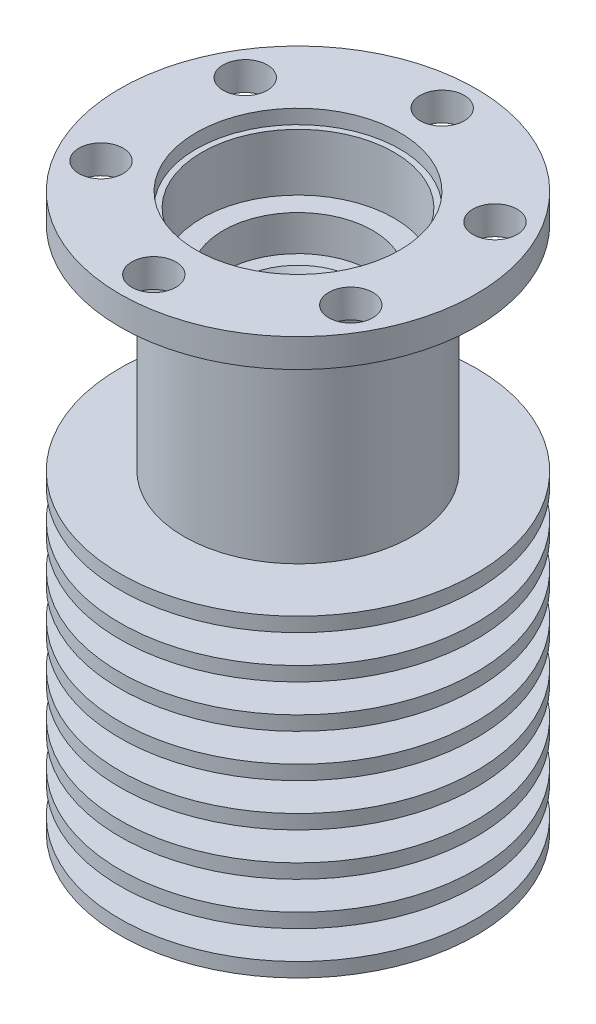
from build123d import *

# Parameters (mm, degrees)
SALIENTE_EXTRUIR1_START = -1
CROQUIS3_R              = 12.5
CROQUIS3_R_2            = 3.25
SALIENTE_EXTRUIR1_DEPTH = 1
MATRIZL1_COUNT          = 8
MATRIZL1_PITCH          = 3
CORTAR_EXTRUIR1_REACH   = 44.819
CROQUIS5_R              = 1.55
MATRIZC1_COUNT          = 6
CHAFL_N3_SIZE           = 0.3
CHAFL_N3_SIZE2          = 0.519615242
CROQUIS6_R              = 7.15
CORTAR_EXTRUIR2_DEPTH   = 1
CHAFL_N2_SIZE           = 0.15
CHAFL_N2_SIZE2          = 0.259807621
CHAFL_N4_SIZE           = 1
CHAFL_N4_SIZE2          = 1.732050808


with BuildPart() as part:
    # Croquis1 → Revolución1 (revolve)
    with BuildSketch(Plane.XY, mode=Mode.PRIVATE) as revoluci_n1_sk:
        Polygon((0, 0), (6, 0), (6, 9), (5.25, 9), (5.25, 12), (4.75, 12), (4.75, 22), (8, 22), (8, 37), (12.5, 37), (12.5, 39), (0, 39), align=None)
    revolve(revoluci_n1_sk.sketch.rotate(Axis((0, 39, 0), (0, -1, 0)), 90), axis=Axis((0, 39, 0), (0, -1, 0)))

    # Croquis2 → Cortar-Revolución1 (revolve, cut)
    with BuildSketch(Plane.XY, mode=Mode.PRIVATE) as cortar_revoluci_n1_sk:
        Polygon((0, 0), (2.5, 0), (2.5, 9), (1.7, 9), (1.7, 11), (3.25, 11), (3.25, 31.5), (5.25, 31.5), (5.25, 34), (6.75, 34), (6.75, 39), (0, 39), align=None)
    revolve(cortar_revoluci_n1_sk.sketch.rotate(Axis((0, 0, 0), (0, 1, 0)), 90), axis=Axis((0, 0, 0), (0, 1, 0)), mode=Mode.SUBTRACT)

    # Croquis3 → Saliente-Extruir1 (add)
    with BuildSketch(Plane.XZ.offset(SALIENTE_EXTRUIR1_START)):
        with Locations(Location((0, 0, 0), (0, 0, 90))):
            Circle(CROQUIS3_R)
        with Locations(Location((0, 0, 0), (0, 0, 270))):
            Circle(CROQUIS3_R_2, mode=Mode.SUBTRACT)
    saliente_extruir1 = extrude(amount=SALIENTE_EXTRUIR1_DEPTH)

    # MatrizL1: Saliente-Extruir1 ×8
    with Locations(*[(0, i * MATRIZL1_PITCH, 0) for i in range(1, MATRIZL1_COUNT)]):
        add(saliente_extruir1)

    # Croquis5 → Cortar-Extruir1 (cut, up to next)
    with BuildSketch(Plane(origin=(0, 39, 0), x_dir=(1, 0, 0), z_dir=(0, 1, 0)), mode=Mode.PRIVATE) as cortar_extruir1_sk1:
        with Locations(Location((0, 10.125, 0), (0, 0, 180))):
            Circle(CROQUIS5_R)
    cortar_extruir1_tool1 = extrude(cortar_extruir1_sk1.sketch, amount=-CORTAR_EXTRUIR1_REACH, mode=Mode.PRIVATE) & part.part
    cortar_extruir1 = cortar_extruir1_tool1.solids().sort_by_distance((0, 39, -10.125))[0]
    add(cortar_extruir1, mode=Mode.SUBTRACT)

    # MatrizC1: Cortar-Extruir1 ×6 about axis
    matrizc1_axis = Axis((0, 0, 0), (0, 1, 0))
    for i in range(1, MATRIZC1_COUNT):
        add(cortar_extruir1.rotate(matrizc1_axis, i * 360 / MATRIZC1_COUNT), mode=Mode.SUBTRACT)

    # Chaflán3
    chafl_n3_edges = [part.edges().sort_by_distance(p)[0] for p in [
        (0, 11, 1.7),
    ]]
    chafl_n3_side = [part.faces().sort_by_distance(p)[0] for p in [
        (0, 11, 1.791923882),
    ]]
    chamfer(chafl_n3_edges, length=CHAFL_N3_SIZE, length2=CHAFL_N3_SIZE2, reference=chafl_n3_side[0])

    # Croquis6 → Cortar-Extruir2 (cut)
    with BuildSketch(Plane(origin=(0, 39, 0), x_dir=(1, 0, 0), z_dir=(0, 1, 0))):
        with Locations(Location((0, 0, 0), (0, 0, 180))):
            Circle(CROQUIS6_R)
    extrude(amount=-CORTAR_EXTRUIR2_DEPTH, mode=Mode.SUBTRACT)

    # Chaflán2
    chafl_n2_edges = [part.edges().sort_by_distance(p)[0] for p in [
        (0, 9, 1.7),
    ]]
    chafl_n2_side = [part.faces().sort_by_distance(p)[0] for p in [
        (0, 9, 2.429289322),
    ]]
    chamfer(chafl_n2_edges, length=CHAFL_N2_SIZE, length2=CHAFL_N2_SIZE2, reference=chafl_n2_side[0])

    # Chaflán4
    chafl_n4_edges = [part.edges().sort_by_distance(p)[0] for p in [
        (0, 31.5, 3.25),
    ]]
    chafl_n4_side = [part.faces().sort_by_distance(p)[0] for p in [
        (0, 31.5, 3.398492424),
    ]]
    chamfer(chafl_n4_edges, length=CHAFL_N4_SIZE, length2=CHAFL_N4_SIZE2, reference=chafl_n4_side[0])


solid = part.part
